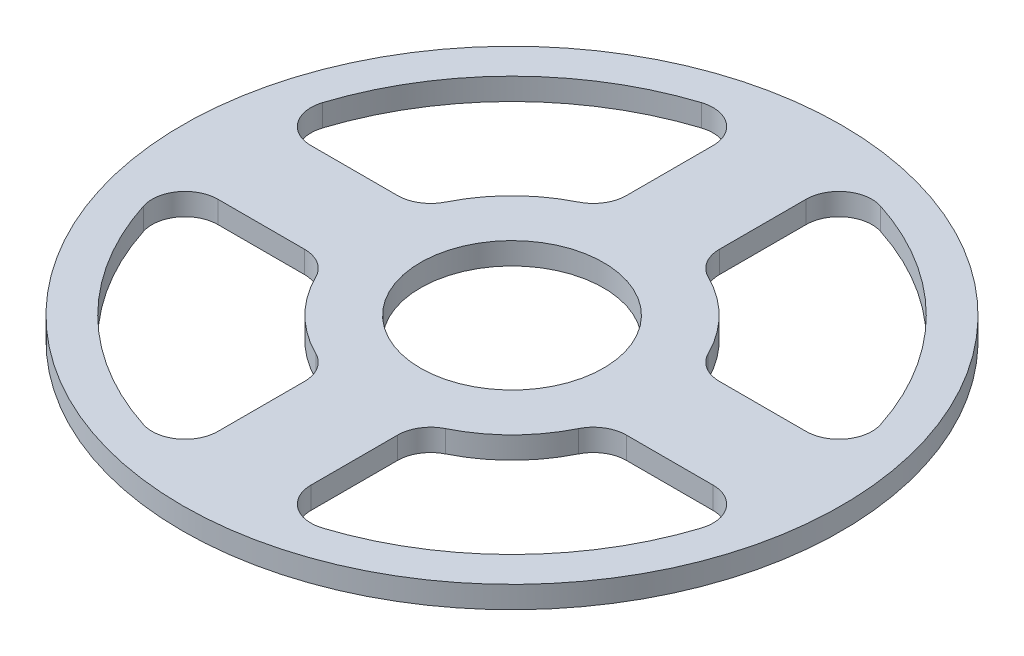
from build123d import *

# Parameters (mm, degrees)
SKETCH_1_R          = 45
EXTRUDE_1_DEPTH     = 3
SKETCH_2_R          = 12.5
CUT_EXTRUDE_1_DEPTH = 64.710281745
FILLET_1_R          = 4.5


with BuildPart() as part:
    # 스케치1 → 보스-돌출1 (new body)
    with BuildSketch(Plane(origin=(0, 0, 0), x_dir=(1, 0, 0), z_dir=(0, 1, 0))):
        with Locations(Location((0, 0, 0), (0, 0, 270))):
            Circle(SKETCH_1_R)
    extrude(amount=EXTRUDE_1_DEPTH)

    # 스케치2 → 컷-돌출1 (cut, through all)
    with BuildSketch(Plane(origin=(0, 3, 0), x_dir=(1, 0, 0), z_dir=(0, 1, 0))):
        with BuildLine():
            ThreePointArc((-39.4927525, 6.35), (-28.284271247, 28.284271247), (-6.35, 39.4927525))
            Line((-6.35, 39.4927525), (-6.35, 18.965165436))
            ThreePointArc((-6.35, 18.965165436), (-14.142135624, 14.142135624), (-18.965165436, 6.35))
            Line((-18.965165436, 6.35), (-39.4927525, 6.35))
        make_face()
        with Locations(Location((0, 0, 0), (0, 0, 270))):
            Circle(SKETCH_2_R)
        with BuildLine():
            ThreePointArc((-18.965165436, -6.35), (-14.142135624, -14.142135624), (-6.35, -18.965165436))
            Line((-6.35, -18.965165436), (-6.35, -39.4927525))
            ThreePointArc((-6.35, -39.4927525), (-28.284271247, -28.284271247), (-39.4927525, -6.35))
            Line((-39.4927525, -6.35), (-18.965165436, -6.35))
        make_face()
        with BuildLine():
            ThreePointArc((39.4927525, -6.35), (28.284271247, -28.284271247), (6.35, -39.4927525))
            Line((6.35, -39.4927525), (6.35, -18.965165436))
            ThreePointArc((6.35, -18.965165436), (14.142135624, -14.142135624), (18.965165436, -6.35))
            Line((18.965165436, -6.35), (39.4927525, -6.35))
        make_face()
        with BuildLine():
            Line((18.965165436, 6.35), (39.4927525, 6.35))
            ThreePointArc((39.4927525, 6.35), (28.284271247, 28.284271247), (6.35, 39.4927525))
            Line((6.35, 39.4927525), (6.35, 18.965165436))
            ThreePointArc((6.35, 18.965165436), (14.142135624, 14.142135624), (18.965165436, 6.35))
        make_face()
    extrude(amount=-CUT_EXTRUDE_1_DEPTH, mode=Mode.SUBTRACT)

    # 필렛1
    fillet_1_edges = [part.edges().sort_by_distance(p)[0] for p in [
        (-18.965165436, 1.5, 6.35),
        (-6.35, 1.5, 18.965165436),
        (-6.35, 1.5, 39.4927525),
        (-39.4927525, 1.5, 6.35),
        (39.4927525, 1.5, 6.35),
        (6.35, 1.5, 39.4927525),
        (6.35, 1.5, 18.965165436),
        (18.965165436, 1.5, 6.35),
        (39.4927525, 1.5, -6.35),
        (18.965165436, 1.5, -6.35),
        (6.35, 1.5, -18.965165436),
        (6.35, 1.5, -39.4927525),
        (-39.4927525, 1.5, -6.35),
        (-6.35, 1.5, -39.4927525),
        (-6.35, 1.5, -18.965165436),
        (-18.965165436, 1.5, -6.35),
    ]]
    fillet(fillet_1_edges, radius=FILLET_1_R)


solid = part.part
